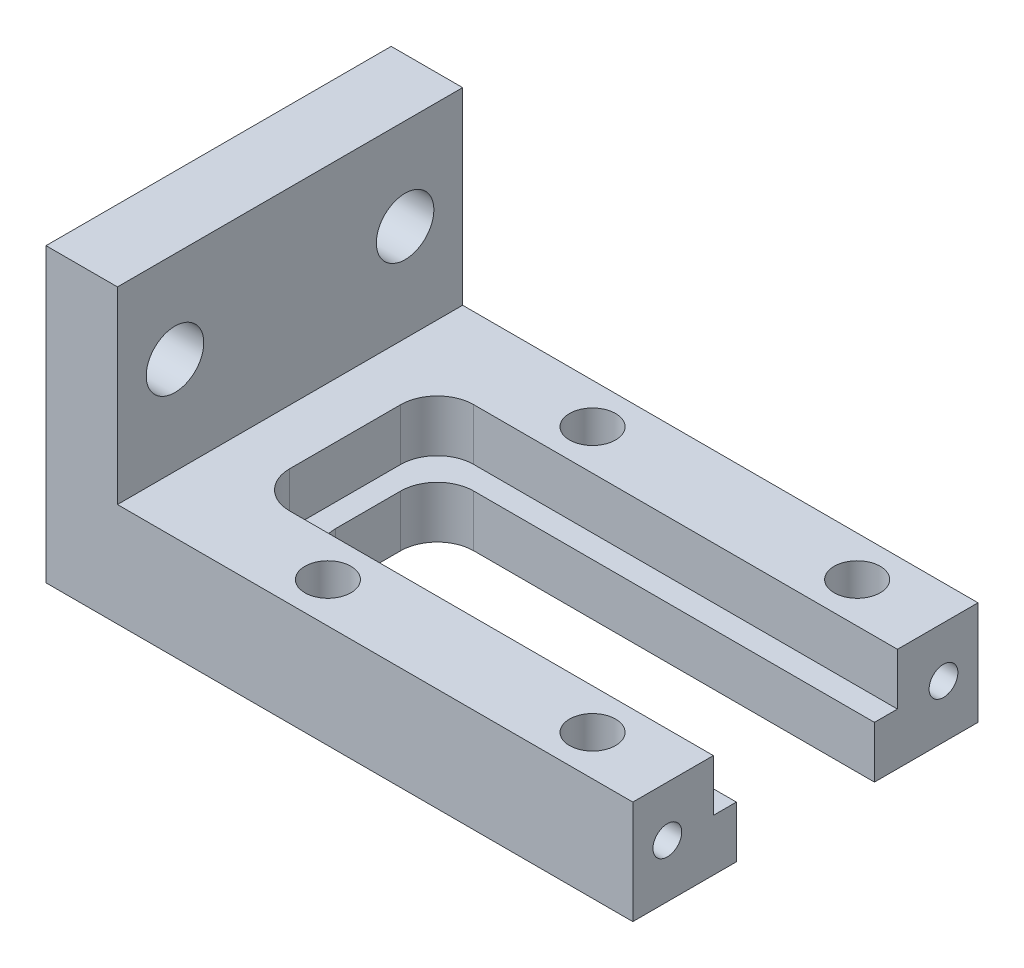
from build123d import *

# Parameters (mm, degrees)
SKETCH1_W                    = 51
SKETCH1_H                    = 30
BOSS_EXTRUDE1_DEPTH          = 9
SKETCH2_W                    = 6.21
SKETCH2_H                    = 30
BOSS_EXTRUDE2_DEPTH          = 16.38
SKETCH3_W                    = 40
SKETCH3_H                    = 16
CUT_EXTRUDE1_DEPTH           = 4.5
FILLET1_R                    = 3.175
CUT_EXTRUDE2_DEPTH           = 37.210832633
F_5_0_5_DIAMETER_HOLE1_D     = 5
F_5_0_5_DIAMETER_HOLE1_DEPTH = 10
F_5_0_5_DIAMETER_HOLE1_TIP   = 1.502151548
F_4_0_4_DIAMETER_HOLE1_D     = 4
F_4_0_4_DIAMETER_HOLE1_DEPTH = 10
F_4_0_4_DIAMETER_HOLE1_TIP   = 1.201721238
M3X0_5_TAPPED_HOLE1_D        = 2.5
M3X0_5_TAPPED_HOLE1_DEPTH    = 7
M3X0_5_TAPPED_HOLE1_TIP      = 0.751075774


with BuildPart() as part:
    # Sketch1 → Boss-Extrude1 (new body)
    with BuildSketch(Plane(origin=(0, 0, 0), x_dir=(1, 0, 0), z_dir=(0, 1, 0))):
        Rectangle(SKETCH1_W, SKETCH1_H)
    extrude(amount=BOSS_EXTRUDE1_DEPTH)

    # Sketch2 → Boss-Extrude2 (add)
    with BuildSketch(Plane(origin=(0, 9, 0), x_dir=(1, 0, 0), z_dir=(0, 1, 0))):
        with Locations((-22.395, 0)):
            Rectangle(SKETCH2_W, SKETCH2_H)
    extrude(amount=BOSS_EXTRUDE2_DEPTH)

    # Sketch3 → Cut-Extrude1 (cut)
    with BuildSketch(Plane(origin=(0, 9, 0), x_dir=(1, 0, 0), z_dir=(0, 1, 0))):
        with Locations((5.5, 0)):
            Rectangle(SKETCH3_W, SKETCH3_H)
    extrude(amount=-CUT_EXTRUDE1_DEPTH, mode=Mode.SUBTRACT)

    # Fillet1
    fillet1_edges = [part.edges().sort_by_distance(p)[0] for p in [
        (-14.5, 6.75, 8),
        (-14.5, 6.75, -8),
    ]]
    fillet(fillet1_edges, radius=FILLET1_R)

    # Sketch5 → Cut-Extrude2 (cut, through all)
    with BuildSketch(Plane(origin=(0, 4.5, 0), x_dir=(1, 0, 0), z_dir=(0, 1, 0))):
        with BuildLine():
            Line((25.5, -6), (-9.325, -6))
            ThreePointArc((-9.325, -6), (-11.57006403, -5.07006403), (-12.5, -2.825))
            Line((-12.5, -2.825), (-12.5, 2.825))
            ThreePointArc((-12.5, 2.825), (-11.57006403, 5.07006403), (-9.325, 6))
            Line((-9.325, 6), (25.5, 6))
            Line((25.5, 6), (25.5, -6))
        make_face()
    extrude(amount=-CUT_EXTRUDE2_DEPTH, mode=Mode.SUBTRACT)

    # Ø5.0 (5) Diameter Hole1
    with Locations(Plane(origin=(-19.29, 0, 0), x_dir=(0, 0, -1), z_dir=(1, 0, 0))):
        with Locations((-10, 17.432129573), (10, 17.432129573)):
            Hole(F_5_0_5_DIAMETER_HOLE1_D / 2, depth=F_5_0_5_DIAMETER_HOLE1_DEPTH)
            with Locations((0, 0, -(F_5_0_5_DIAMETER_HOLE1_DEPTH + F_5_0_5_DIAMETER_HOLE1_TIP / 2))):  # 118° drill point
                Cone(0, F_5_0_5_DIAMETER_HOLE1_D / 2, F_5_0_5_DIAMETER_HOLE1_TIP, mode=Mode.SUBTRACT)

    # Ø4.0 (4) Diameter Hole1
    with Locations(Plane(origin=(0, 9, 0), x_dir=(1, 0, 0), z_dir=(0, 1, 0))):
        with Locations((73.579545509, -261.26638596), (-4.5, -11.5), (18.5, -11.5), (18.5, 11.5), (-4.5, 11.5)):
            Hole(F_4_0_4_DIAMETER_HOLE1_D / 2, depth=F_4_0_4_DIAMETER_HOLE1_DEPTH)
            with Locations((0, 0, -(F_4_0_4_DIAMETER_HOLE1_DEPTH + F_4_0_4_DIAMETER_HOLE1_TIP / 2))):  # 118° drill point
                Cone(0, F_4_0_4_DIAMETER_HOLE1_D / 2, F_4_0_4_DIAMETER_HOLE1_TIP, mode=Mode.SUBTRACT)

    # M3x0.5 Tapped Hole1
    with Locations(Plane(origin=(25.5, 0, 0), x_dir=(0, 0, -1), z_dir=(1, 0, 0))):
        with Locations((-12, 4.623330266), (12, 4.623330266)):
            Hole(M3X0_5_TAPPED_HOLE1_D / 2, depth=M3X0_5_TAPPED_HOLE1_DEPTH)
            with Locations((0, 0, -(M3X0_5_TAPPED_HOLE1_DEPTH + M3X0_5_TAPPED_HOLE1_TIP / 2))):  # 118° drill point
                Cone(0, M3X0_5_TAPPED_HOLE1_D / 2, M3X0_5_TAPPED_HOLE1_TIP, mode=Mode.SUBTRACT)


solid = part.part
